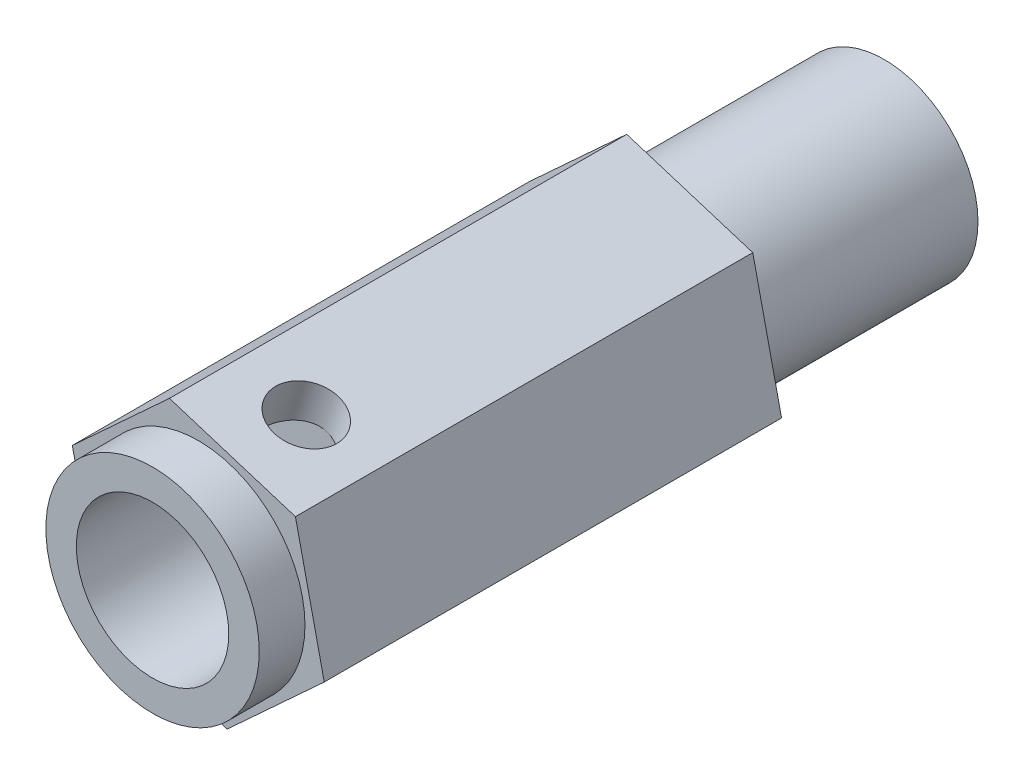
from build123d import *

# Parameters (mm, degrees)
SKETCH_1_R          = 6.15
EXTRUDE_1_DEPTH     = 15
EXTRUDE_2_DEPTH     = 30
SKETCH_3_R          = 7
EXTRUDE_3_DEPTH     = 3
SKETCH_4_R          = 5
CUT_EXTRUDE_1_DEPTH = 10
M5X0_8_1_REACH      = 53.556
M5X0_8_1_BORE_R     = 2.1


with BuildPart() as part:
    # 草图1 → 凸台-拉伸1 (new body)
    with BuildSketch(Plane.XY):
        Circle(SKETCH_1_R)
    extrude(amount=EXTRUDE_1_DEPTH)

    # 草图2 → 凸台-拉伸2 (add)
    with BuildSketch(Plane.XY.offset(15)):
        Polygon((6.373936419, 5.862843552), (-1.890403245, 8.451412638), (-8.264339665, 2.588569085), (-6.373936419, -5.862843552), (1.890403245, -8.451412638), (8.264339665, -2.588569085), align=None)
    extrude(amount=EXTRUDE_2_DEPTH)

    # 草图3 → 凸台-拉伸3 (add)
    with BuildSketch(Plane.XY.offset(45)):
        Circle(SKETCH_3_R)
    extrude(amount=EXTRUDE_3_DEPTH)

    # 草图4 → 切除-拉伸1 (cut)
    with BuildSketch(Plane.XY.offset(48)):
        Circle(SKETCH_4_R)
    extrude(amount=-CUT_EXTRUDE_1_DEPTH, mode=Mode.SUBTRACT)

    # M5x0.8 螺纹孔1 bore → M5x0.8 螺纹孔1 (cut, up to next)
    with BuildSketch(Plane(origin=(2.241766587, 7.157128095, 0), x_dir=(-0.9542837460036324, 0.2989022116232579, 0), z_dir=(0.2989022116232579, 0.9542837460036325, 0)), mode=Mode.PRIVATE) as m5x0_8_1_sk1:
        with Locations((0, 40.158364076)):
            Circle(M5X0_8_1_BORE_R)
    m5x0_8_1_tool1 = extrude(m5x0_8_1_sk1.sketch, amount=-M5X0_8_1_REACH, mode=Mode.PRIVATE) & part.part
    add(m5x0_8_1_tool1.solids().sort_by_distance((2.241767, 7.157128, 40.158364))[0], mode=Mode.SUBTRACT)


solid = part.part
